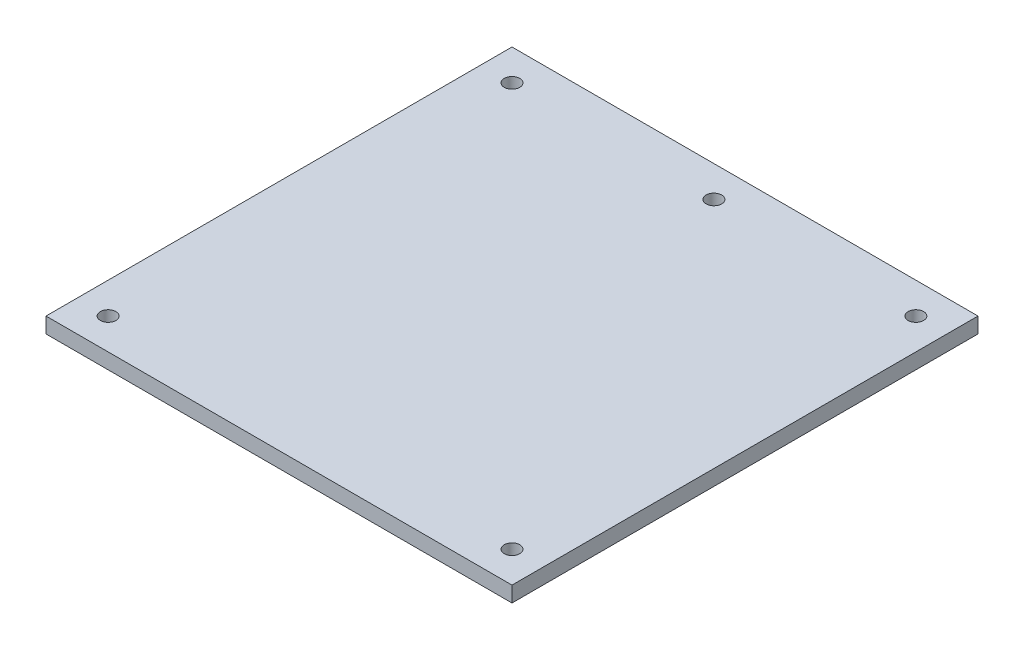
from build123d import *

# Parameters (mm, degrees)
ESBO_O1_W                = 300
ESBO_O1_H                = 300
ESBO_O1_R                = 5
RESSALTO_EXTRUS_O1_DEPTH = 10


with BuildPart() as part:
    # Esboço1 → Ressalto-extrusão1 (new body)
    with BuildSketch(Plane(origin=(0, 0, 0), x_dir=(1, 0, 0), z_dir=(0, 1, 0))):
        with Locations((124.594594595, -136.351351351)):
            Rectangle(ESBO_O1_W, ESBO_O1_H)
        with Locations(Location((-5.405405405, -6.351351351, 0), (0, 0, 270))):
            Circle(ESBO_O1_R, mode=Mode.SUBTRACT)
        with Locations(Location((254.594594595, -6.351351351, 0), (0, 0, 90))):
            Circle(ESBO_O1_R, mode=Mode.SUBTRACT)
        with Locations(Location((254.594594595, -266.351351351, 0), (0, 0, 270))):
            Circle(ESBO_O1_R, mode=Mode.SUBTRACT)
        with Locations(Location((-5.405405405, -266.351351351, 0), (0, 0, 90))):
            Circle(ESBO_O1_R, mode=Mode.SUBTRACT)
        with Locations(Location((124.594594595, -6.351351351, 0), (0, 0, 90))):
            Circle(ESBO_O1_R, mode=Mode.SUBTRACT)
    extrude(amount=RESSALTO_EXTRUS_O1_DEPTH)


solid = part.part
